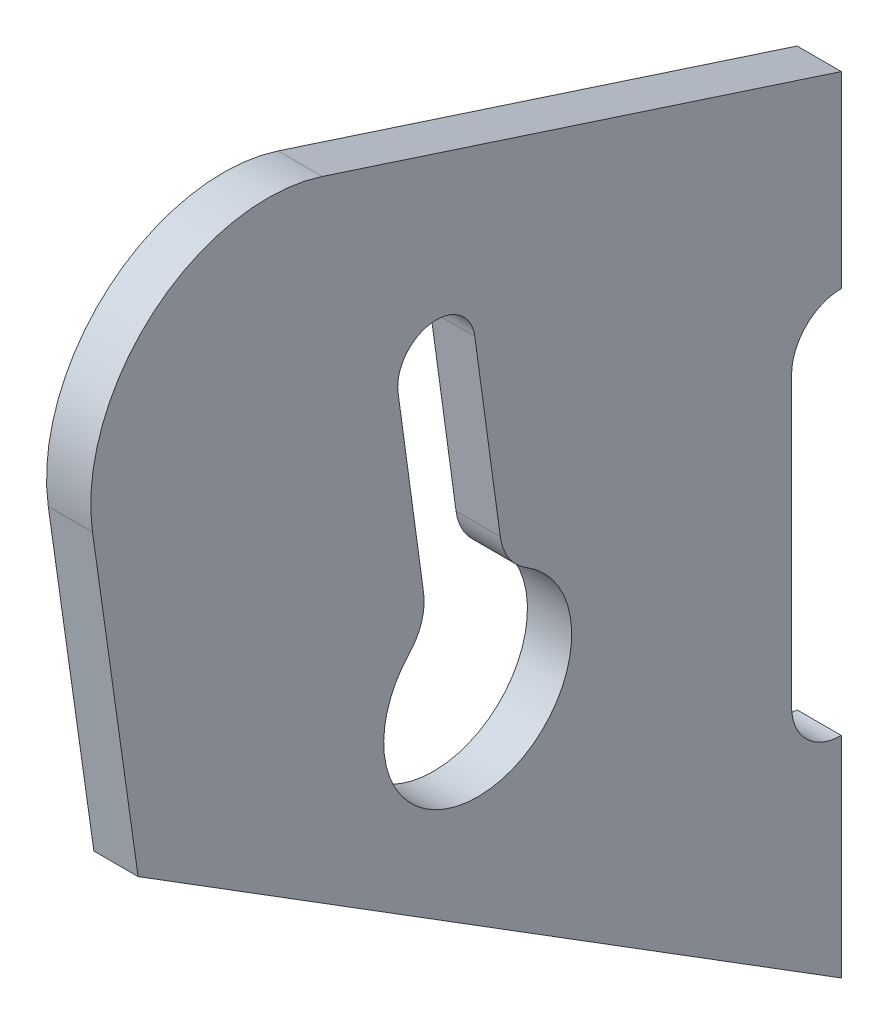
from build123d import *

# Parameters (mm, degrees)
BOSS_EXTRUDE1_DEPTH = 4
FILLET1_R           = 10


with BuildPart() as part:
    # Sketch1 → Boss-Extrude1 (new, symmetric)
    with BuildSketch(Plane.YZ):
        with BuildLine():
            Line((79.487889635, 127.207214423), (0, 0))
            Line((0, 0), (38, 0))
            ThreePointArc((38, 0), (40.636038969, 6.363961031), (47, 9))
            Line((47, 9), (99, 9))
            ThreePointArc((99, 9), (105.363961031, 6.363961031), (108, 0))
            Line((108, 0), (142, 0))
            Line((142, 0), (172.50354814, 93.880267937))
            ThreePointArc((172.50354814, 93.880267937), (166.569139078, 124.354715336), (137.573015724, 135.451290736))
            Line((137.573015724, 135.451290736), (79.487889635, 127.207214423))
        make_face()
        with BuildLine():
            ThreePointArc((94.543501955, 60.945796393), (61.402056741, 63.469750476), (92.64280616, 74.816173298))
            Line((92.64280616, 74.816173298), (131.785075785, 80.179945877))
            ThreePointArc((131.785075785, 80.179945877), (139.670612135, 74.195105322), (133.68577158, 66.309568971))
            Line((133.68577158, 66.309568971), (94.543501955, 60.945796393))
        make_face(mode=Mode.SUBTRACT)
    extrude(amount=BOSS_EXTRUDE1_DEPTH, both=True)

    # Fillet1
    fillet1_edges = [part.edges().sort_by_distance(p)[0] for p in [
        (0, 92.64280616, 74.816173298),
        (0, 94.543501955, 60.945796393),
    ]]
    fillet(fillet1_edges, radius=FILLET1_R)


solid = part.part
